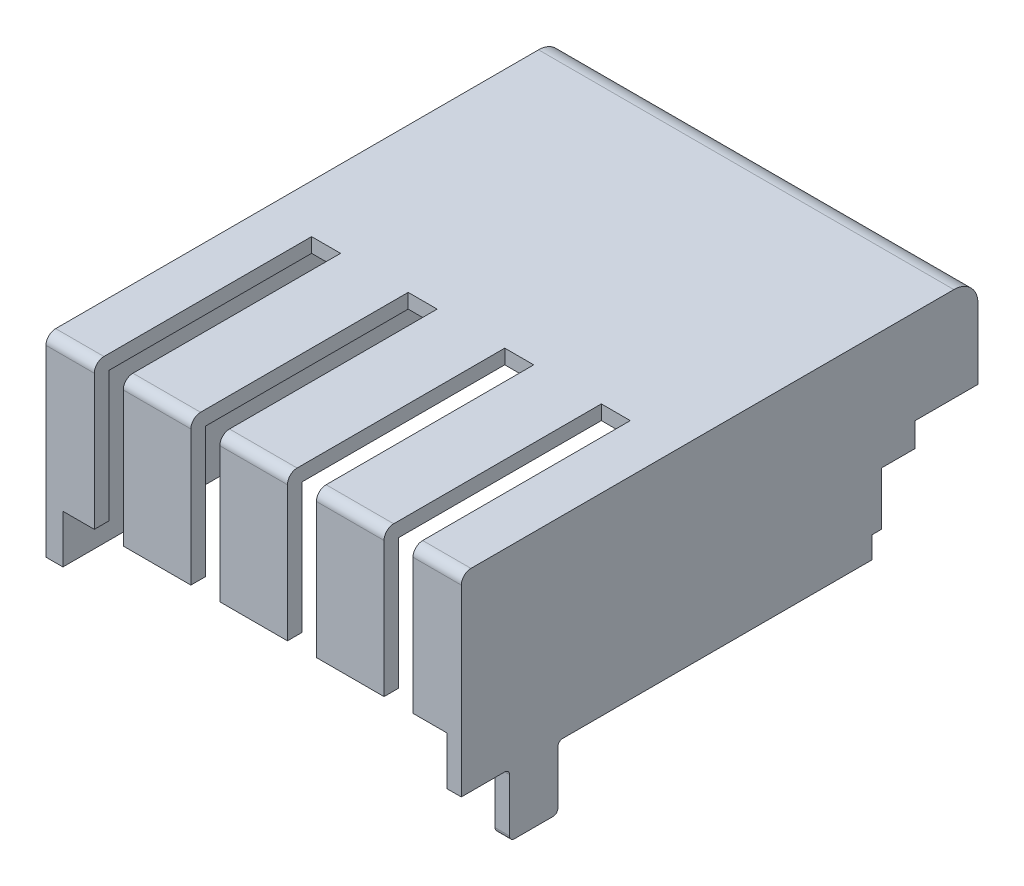
from build123d import *

# Parameters (mm, degrees)
SALIENTE_EXTRUIR1_DEPTH = 107
CROQUIS2_W              = 90
CROQUIS2_H              = 18
SALIENTE_EXTRUIR2_DEPTH = 3
CROQUIS4_W              = 90
CROQUIS4_H              = 30
SALIENTE_EXTRUIR3_DEPTH = 3
REDONDEO3_R             = 2
CROQUIS3_W              = 6
CROQUIS3_H              = 45
CORTAR_EXTRUIR1_DEPTH   = 123.776219196
REDONDEO1_R             = 5
SALIENTE_EXTRUIR4_DEPTH = 3.5
CORTAR_EXTRUIR3_START   = -3
CORTAR_EXTRUIR3_DEPTH   = 3
CORTAR_EXTRUIR4_DEPTH   = 144.589693223
SALIENTE_EXTRUIR5_DEPTH = 3
REDONDEO4_R             = 1
SALIENTE_EXTRUIR6_DEPTH = 1
CORTAR_EXTRUIR6_DEPTH   = 1


with BuildPart() as part:
    # Croquis1 → Saliente-Extruir1 (new body)
    with BuildSketch(Plane.XY):
        Polygon((-42, 0), (-45, 0), (-45, 40), (45, 40), (45, 0), (42, 0), (42, 37), (-42, 37), align=None)
    extrude(amount=-SALIENTE_EXTRUIR1_DEPTH)

    # Croquis2 → Saliente-Extruir2 (add)
    with BuildSketch(Plane(origin=(0, 0, -107), x_dir=(-1, 0, 0), z_dir=(0, 0, -1))):
        with Locations((0, 31)):
            Rectangle(CROQUIS2_W, CROQUIS2_H)
    extrude(amount=-SALIENTE_EXTRUIR2_DEPTH)

    # Croquis4 → Saliente-Extruir3 (add)
    with BuildSketch(Plane.XY):
        with Locations((0, 25)):
            Rectangle(CROQUIS4_W, CROQUIS4_H)
    extrude(amount=-SALIENTE_EXTRUIR3_DEPTH)

    # Redondeo3
    redondeo3_edges = [part.edges().sort_by_distance(p)[0] for p in [
        (0, 40, 0),
    ]]
    fillet(redondeo3_edges, radius=REDONDEO3_R)

    # Croquis3 → Cortar-Extruir1 (cut, through all)
    with BuildSketch(Plane(origin=(0, 40, 0), x_dir=(1, 0, 0), z_dir=(0, 1, 0))):
        with Locations((-9, 22.5)):
            Rectangle(CROQUIS3_W, CROQUIS3_H)
        with Locations((11, 22.5)):
            Rectangle(CROQUIS3_W, CROQUIS3_H)
        with Locations((-29, 22.5)):
            Rectangle(CROQUIS3_W, CROQUIS3_H)
        with Locations((31, 22.5)):
            Rectangle(CROQUIS3_W, CROQUIS3_H)
    extrude(amount=-CORTAR_EXTRUIR1_DEPTH, mode=Mode.SUBTRACT)

    # Redondeo1
    redondeo1_edges = [part.edges().sort_by_distance(p)[0] for p in [
        (0, 40, -107),
    ]]
    fillet(redondeo1_edges, radius=REDONDEO1_R)

    # Croquis6 → Saliente-Extruir4 (add)
    with BuildSketch(Plane(origin=(-42, 0, 0), x_dir=(0, 0, -1), z_dir=(1, 0, 0))):
        Polygon((3, 10), (0, 10), (0, 0), (107, 0), (107, 22), (104, 22), (104, 37), (3, 37), align=None)
    extrude(amount=SALIENTE_EXTRUIR4_DEPTH)

    # Croquis7 → Cortar-Extruir3 (cut)
    with BuildSketch(Plane.ZY.offset(45).offset(CORTAR_EXTRUIR3_START)):
        with BuildLine():
            Line((-2, 40), (-102, 40))
            ThreePointArc((-102, 40), (-105.535533906, 38.535533906), (-107, 35))
            Line((-107, 35), (-107, 0))
            Line((-107, 0), (0, 0))
            Line((0, 0), (0, 38))
            ThreePointArc((0, 38), (-0.585786438, 39.414213562), (-2, 40))
        make_face()
    extrude(amount=CORTAR_EXTRUIR3_DEPTH, mode=Mode.SUBTRACT)

    # Croquis8 → Cortar-Extruir4 (cut, through all)
    with BuildSketch(Plane.ZY.offset(42)):
        Polygon((-107, 0), (-94, 0), (-87, 0), (-85, 0), (-85, 4.5), (-87, 4.5), (-87, 15.5), (-94, 15.5), (-94, 20.5), (-107, 20.5), align=None)
    extrude(amount=-CORTAR_EXTRUIR4_DEPTH, mode=Mode.SUBTRACT)

    # Croquis9 → Saliente-Extruir5 (add)
    with BuildSketch(Plane(origin=(45, 0, 0), x_dir=(0, 0, -1), z_dir=(1, 0, 0))):
        with BuildLine():
            Line((10, 0), (20, 0))
            Line((20, 0), (20, -12))
            ThreePointArc((20, -12), (19.707106781, -12.707106781), (19, -13))
            Line((19, -13), (11, -13))
            ThreePointArc((11, -13), (10.292893219, -12.707106781), (10, -12))
            Line((10, -12), (10, 0))
        make_face()
    extrude(amount=-SALIENTE_EXTRUIR5_DEPTH)

    # Redondeo4
    redondeo4_edges = [part.edges().sort_by_distance(p)[0] for p in [
        (43.5, 0, -10),
        (43.5, 0, -20),
    ]]
    fillet(redondeo4_edges, radius=REDONDEO4_R)

    # Croquis11 → Saliente-Extruir6 (add)
    with BuildSketch(Plane.ZY.offset(-42)):
        with BuildLine():
            Line((-107, 20.5), (-94, 20.5))
            Line((-94, 20.5), (-94, 15.5))
            Line((-94, 15.5), (-87, 15.5))
            Line((-87, 15.5), (-87, 4.5))
            Line((-87, 4.5), (-85, 4.5))
            Line((-85, 4.5), (-85, 0))
            Line((-85, 0), (-21, 0))
            ThreePointArc((-21, 0), (-20.292893219, -0.292893219), (-20, -1))
            Line((-20, -1), (-20, -12))
            ThreePointArc((-20, -12), (-19.707106781, -12.707106781), (-19, -13))
            Line((-19, -13), (-11, -13))
            ThreePointArc((-11, -13), (-10.292893219, -12.707106781), (-10, -12))
            Line((-10, -12), (-10, -1))
            ThreePointArc((-10, -1), (-9.707106781, -0.292893219), (-9, 0))
            Line((-9, 0), (0, 0))
            Line((0, 0), (0, 10))
            Line((0, 10), (-3, 10))
            Line((-3, 10), (-3, 37))
            Line((-3, 37), (-104, 37))
            Line((-104, 37), (-104, 22))
            Line((-104, 22), (-107, 22))
            Line((-107, 22), (-107, 20.5))
        make_face()
    extrude(amount=SALIENTE_EXTRUIR6_DEPTH)

    # Croquis12 → Cortar-Extruir6 (cut)
    with BuildSketch(Plane(origin=(45, 0, 0), x_dir=(0, 0, -1), z_dir=(1, 0, 0))):
        with BuildLine():
            Line((94, 20.5), (107, 20.5))
            Line((107, 20.5), (107, 35))
            ThreePointArc((107, 35), (105.535533906, 38.535533906), (102, 40))
            Line((102, 40), (2, 40))
            ThreePointArc((2, 40), (0.585786438, 39.414213562), (0, 38))
            Line((0, 38), (0, 0))
            Line((0, 0), (9, 0))
            ThreePointArc((9, 0), (9.707106781, -0.292893219), (10, -1))
            Line((10, -1), (10, -12))
            ThreePointArc((10, -12), (10.292893219, -12.707106781), (11, -13))
            Line((11, -13), (19, -13))
            ThreePointArc((19, -13), (19.707106781, -12.707106781), (20, -12))
            Line((20, -12), (20, -1))
            ThreePointArc((20, -1), (20.292893219, -0.292893219), (21, 0))
            Line((21, 0), (85, 0))
            Line((85, 0), (85, 4.5))
            Line((85, 4.5), (87, 4.5))
            Line((87, 4.5), (87, 15.5))
            Line((87, 15.5), (94, 15.5))
            Line((94, 15.5), (94, 20.5))
        make_face()
    extrude(amount=-CORTAR_EXTRUIR6_DEPTH, mode=Mode.SUBTRACT)


solid = part.part
